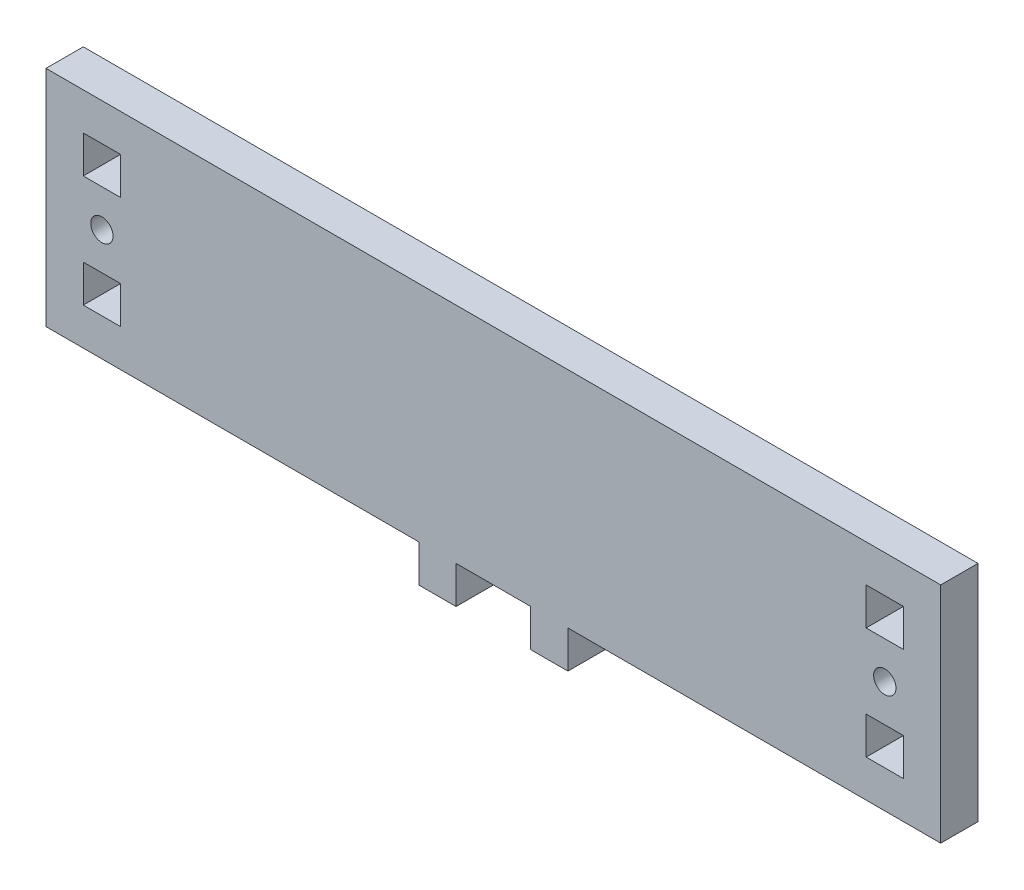
from build123d import *

# Parameters (mm, degrees)
SKETCH1_R           = 1.5
SKETCH1_W           = 5
SKETCH1_H           = 5
BOSS_EXTRUDE1_DEPTH = 5


with BuildPart() as part:
    # Sketch1 → Boss-Extrude1 (new body)
    with BuildSketch(Plane.XY):
        Polygon((0, 0), (0, 5.015390442), (-10, 5.015390442), (-10, 0), (-15, 0), (-15, 5.015390442), (-65, 5.015390442), (-65, 35.015390442), (55, 35.015390442), (55, 5.015390442), (5, 5.015390442), (5, 0), align=None)
        with Locations((-57.5, 20.015390442)):
            Circle(SKETCH1_R, mode=Mode.SUBTRACT)
        with Locations((47.5, 20.015390442)):
            Circle(SKETCH1_R, mode=Mode.SUBTRACT)
        with Locations((-57.5, 12.515390442)):
            Rectangle(SKETCH1_W, SKETCH1_H, mode=Mode.SUBTRACT)
        with Locations((-57.5, 27.515390442)):
            Rectangle(SKETCH1_W, SKETCH1_H, mode=Mode.SUBTRACT)
        with Locations((47.5, 12.515390442)):
            Rectangle(SKETCH1_W, SKETCH1_H, mode=Mode.SUBTRACT)
        with Locations((47.5, 27.515390442)):
            Rectangle(SKETCH1_W, SKETCH1_H, mode=Mode.SUBTRACT)
    extrude(amount=BOSS_EXTRUDE1_DEPTH)


solid = part.part
